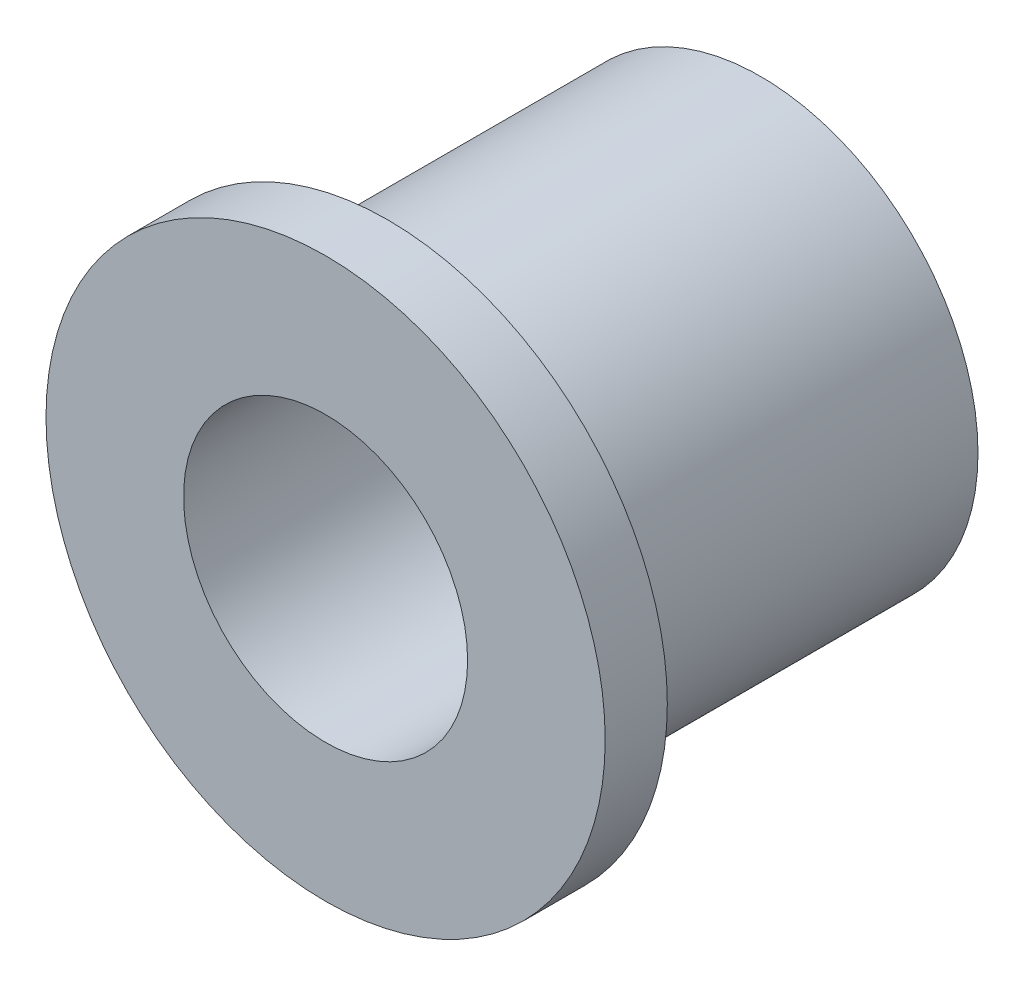
from build123d import *


with BuildPart() as part:
    # Sketch1 → Revolve1 (revolve)
    with BuildSketch(Plane(origin=(0, 0, 0), x_dir=(1, 0, 0), z_dir=(0, 1, 0)), mode=Mode.PRIVATE) as revolve1_sk:
        Polygon((-3.628571429, 0), (-7.14375, 0), (-7.14375, 1.5875), (-5.55625, 1.5875), (-5.55625, 11.1125), (-3.628571429, 11.1125), align=None)
    revolve(revolve1_sk.sketch.rotate(Axis((0, 0, 0), (0, 0, -1)), 180), axis=Axis((0, 0, 0), (0, 0, -1)))


solid = part.part
